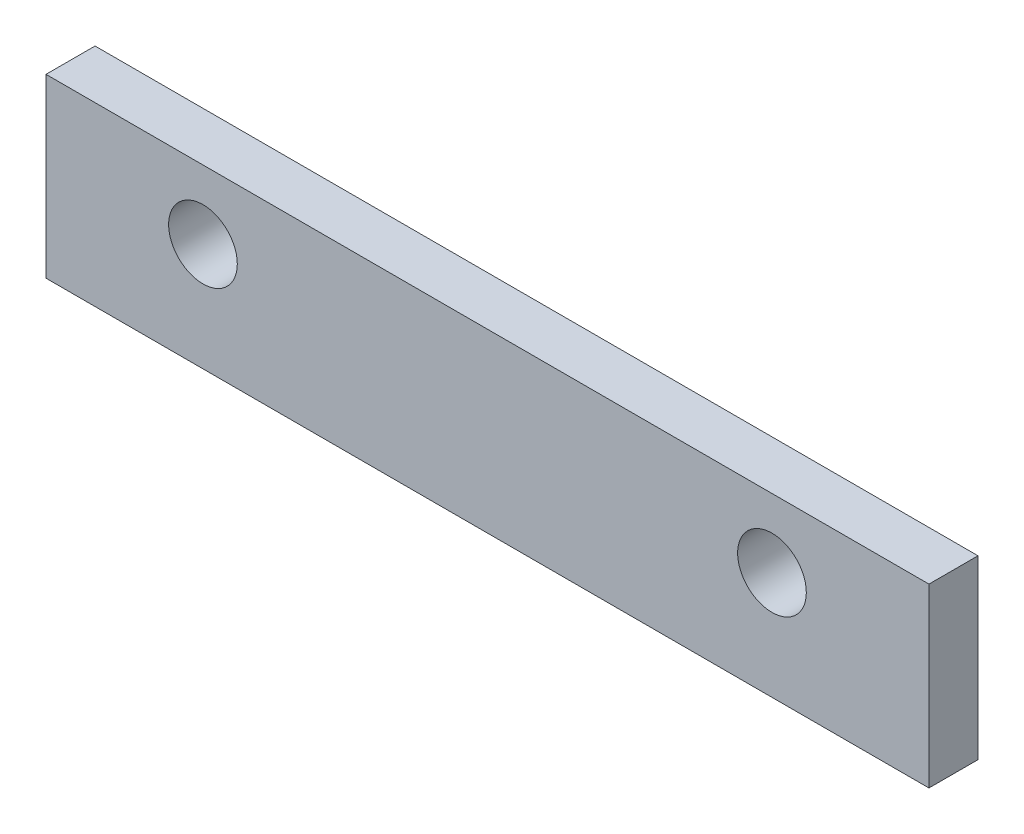
from build123d import *

# Parameters (mm, degrees)
SKETCH1_W           = 45
SKETCH1_H           = 9
SKETCH1_R           = 1.75
BOSS_EXTRUDE1_DEPTH = 2.5


with BuildPart() as part:
    # Sketch1 → Boss-Extrude1 (new body)
    with BuildSketch(Plane.XY):
        Rectangle(SKETCH1_W, SKETCH1_H)
        with Locations((-14.5, 1)):
            Circle(SKETCH1_R, mode=Mode.SUBTRACT)
        with Locations((14.5, 1)):
            Circle(SKETCH1_R, mode=Mode.SUBTRACT)
    extrude(amount=BOSS_EXTRUDE1_DEPTH)


solid = part.part
